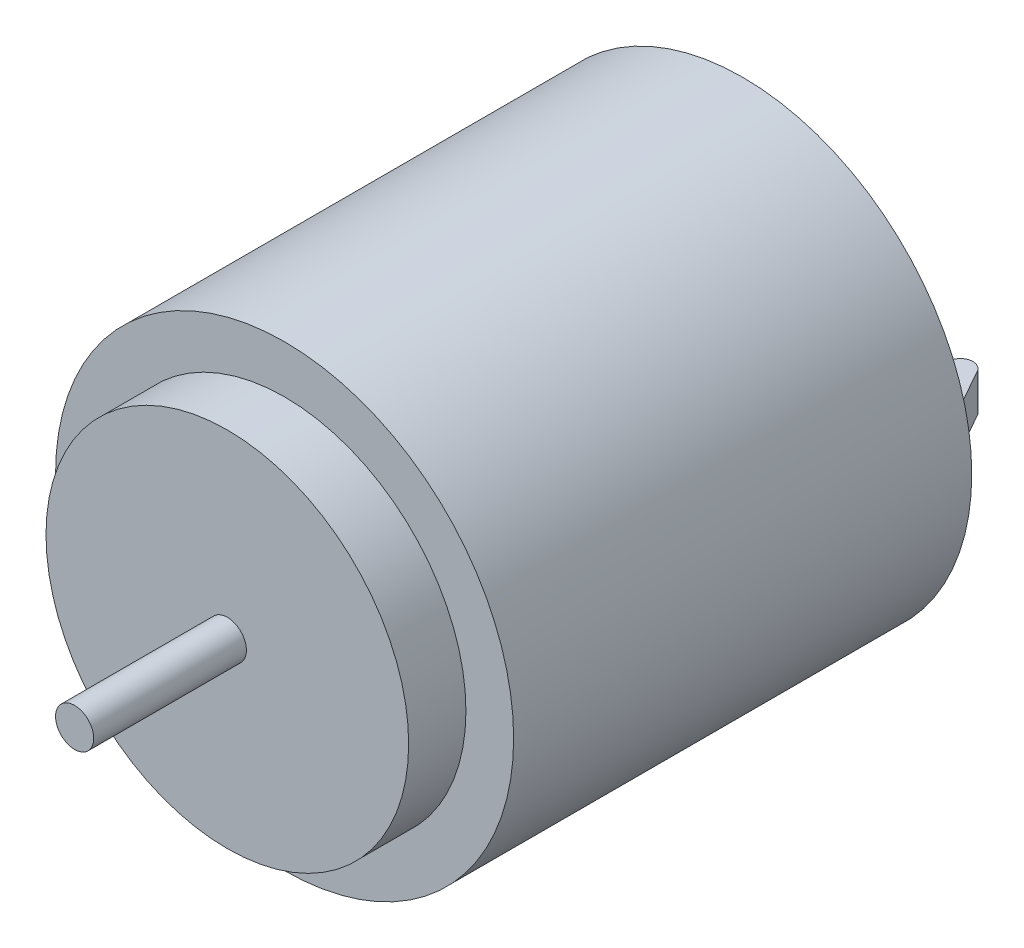
from build123d import *

# Parameters (mm, degrees)
BOSS_EXTRUDE1_DEPTH = 1


with BuildPart() as part:
    # Sketch1 → Revolve1 (revolve)
    with BuildSketch(Plane(origin=(0, 0, 0), x_dir=(1, 0, 0), z_dir=(0, 1, 0))):
        Polygon((0, 15.606821862), (12, 15.606821862), (12, -8.393178138), (9.5, -8.393178138), (9.5, -11.393178138), (1, -11.393178138), (1, -19.393178138), (0, -19.393178138), align=None)
    revolve(axis=Axis((0, 0, 19.393178138), (0, 0, -1)))

    # Sketch3 → Boss-Extrude1 (add, symmetric)
    with BuildSketch(Plane(origin=(0, 0, 0), x_dir=(1, 0, 0), z_dir=(0, 1, 0))):
        with BuildLine():
            Line((9.289467417, 15.291250115), (7.355842044, 18.774923355))
            ThreePointArc((7.355842044, 18.774923355), (7.60881313, 19.659037934), (8.492927709, 19.406066848))
            Line((8.492927709, 19.406066848), (10.426553083, 15.922393608))
            ThreePointArc((10.426553083, 15.922393608), (10.173581996, 15.038279029), (9.289467417, 15.291250115))
        make_face()
        with BuildLine():
            Line((-9.289467417, 15.291250115), (-7.355842044, 18.774923355))
            ThreePointArc((-7.355842044, 18.774923355), (-7.60881313, 19.659037934), (-8.492927709, 19.406066848))
            Line((-8.492927709, 19.406066848), (-10.426553083, 15.922393608))
            ThreePointArc((-10.426553083, 15.922393608), (-10.173581996, 15.038279029), (-9.289467417, 15.291250115))
        make_face()
    extrude(amount=BOSS_EXTRUDE1_DEPTH, both=True)


solid = part.part
